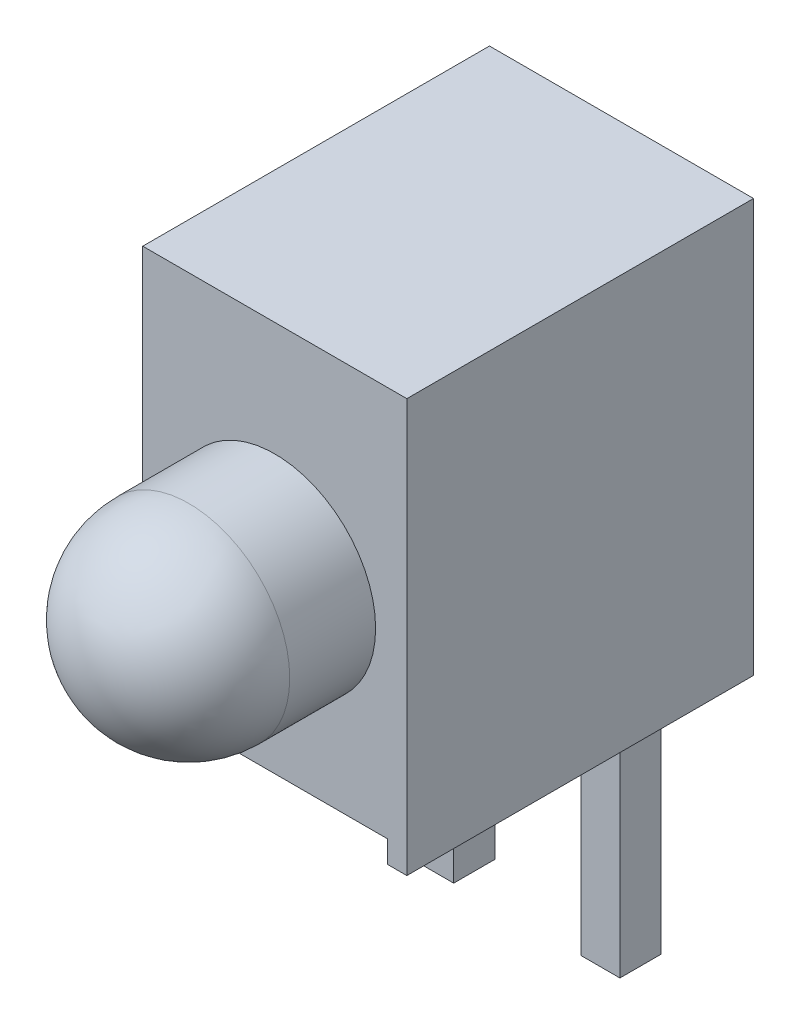
from build123d import *

# Parameters (mm, degrees)
SKETCH1_W           = 4.06
SKETCH1_H           = 5.33
BOSS_EXTRUDE1_DEPTH = 6.35
SKETCH2_R           = 1.55
BOSS_EXTRUDE2_DEPTH = 2.8702
FILLET2_R           = 1.55
SKETCH4_W           = 3.493828458
SKETCH4_H           = 0.340679683
CUT_EXTRUDE1_DEPTH  = 9.53535588
SKETCH6_W           = 0.6
SKETCH6_H           = 0.632779055
SKETCH6_H_2         = 0.632779056
BOSS_EXTRUDE5_DEPTH = 3.81


with BuildPart() as part:
    # Sketch1 → Boss-Extrude1 (new body)
    with BuildSketch(Plane(origin=(0, 0, 0), x_dir=(1, 0, 0), z_dir=(0, 1, 0))):
        Rectangle(SKETCH1_W, SKETCH1_H)
    extrude(amount=BOSS_EXTRUDE1_DEPTH)

    # Sketch2 → Boss-Extrude2 (add)
    with BuildSketch(Plane.XY.offset(2.665)):
        with Locations(Location((0, 3.05, 0), (0, 0, 180))):
            Circle(SKETCH2_R)
    extrude(amount=BOSS_EXTRUDE2_DEPTH)

    # Fillet2
    fillet2_edges = [part.edges().sort_by_distance(p)[0] for p in [
        (1.55, 3.05, 5.5352),
    ]]
    fillet(fillet2_edges, radius=FILLET2_R)

    # Sketch4 → Cut-Extrude1 (cut, through all)
    with BuildSketch(Plane.XY.offset(2.665)):
        with Locations((-0.015737966, 0.170339842)):
            Rectangle(SKETCH4_W, SKETCH4_H)
    extrude(amount=-CUT_EXTRUDE1_DEPTH, mode=Mode.SUBTRACT)

    # Sketch6 → Boss-Extrude5 (add)
    with BuildSketch(Plane.XZ.offset(-0.340679683)):
        with Locations((-1.278193782, -1.380000213)):
            Rectangle(SKETCH6_W, SKETCH6_H)
        with Locations((1.261806218, -1.395)):
            Rectangle(SKETCH6_W, SKETCH6_H_2)
    extrude(amount=BOSS_EXTRUDE5_DEPTH)


solid = part.part
